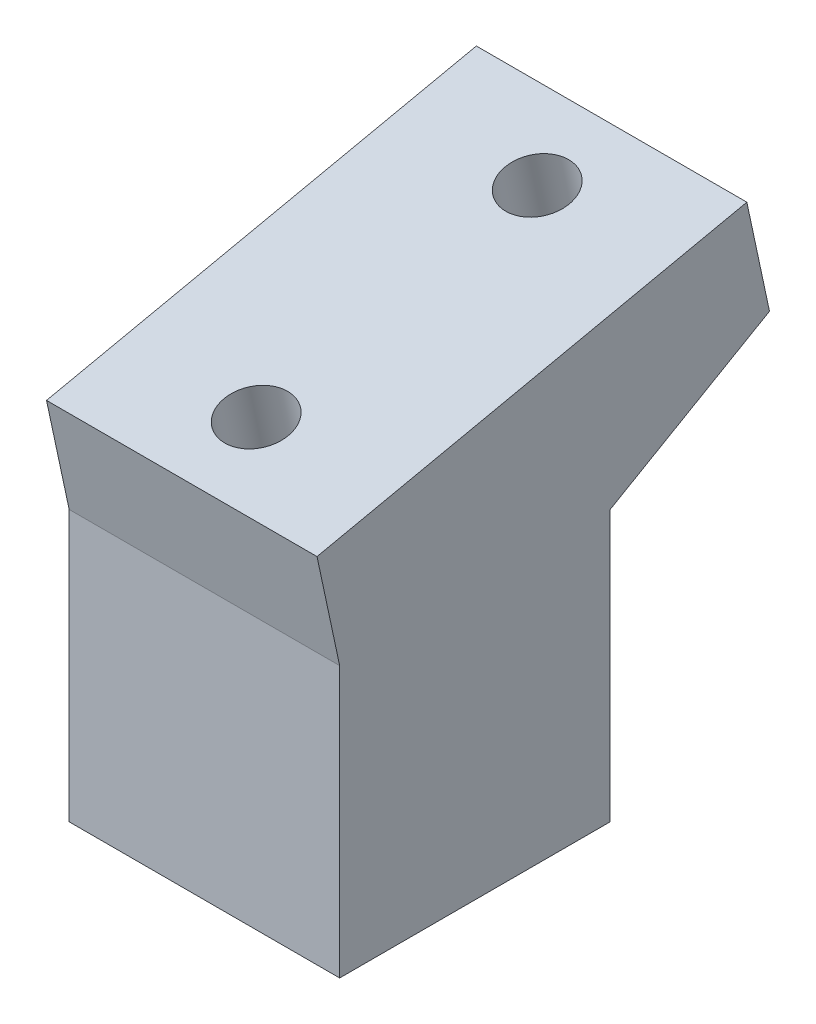
from build123d import *

# Parameters (mm, degrees)
SKETCH_1_W          = 8
SKETCH_1_H          = 8
SKETCH_1_W_2        = 3.05
SKETCH_1_H_2        = 3.05
EXTRUDE_1_DEPTH     = 7.5
SKETCH_2_W          = 8
SKETCH_2_H          = 8
EXTRUDE_2_DEPTH     = 0.5
EXTRUDE_3_DEPTH     = 8
SKETCH_4_R          = 0.95
EXTRUDE_4_DEPTH     = 4
SKETCH_4_2_R        = 0.95
CUT_EXTRUDE_1_DEPTH = 4.2


with BuildPart() as part:
    # 草图1 → 凸台-拉伸1 (new body)
    with BuildSketch(Plane(origin=(0, 0, 0), x_dir=(1, 0, 0), z_dir=(0, 1, 0))):
        with Locations((4, 4)):
            Rectangle(SKETCH_1_W, SKETCH_1_H)
        with Locations((4, 4)):
            Rectangle(SKETCH_1_W_2, SKETCH_1_H_2, mode=Mode.SUBTRACT)
    extrude(amount=EXTRUDE_1_DEPTH)

    # 草图2 → 凸台-拉伸2 (add)
    with BuildSketch(Plane(origin=(0, 7.5, 0), x_dir=(1, 0, 0), z_dir=(0, 1, 0))):
        with Locations((4, 4)):
            Rectangle(SKETCH_2_W, SKETCH_2_H)
    extrude(amount=EXTRUDE_2_DEPTH)

    # 草图3 → 凸台-拉伸3 (add)
    with BuildSketch(Plane(origin=(8, 0, 0), x_dir=(0, 0, -1), z_dir=(1, 0, 0))):
        Polygon((12.042467117, 13.849699628), (12.712142643, 10.720556823), (0, 8), (-0.669675526, 11.129142804), align=None)
        Polygon((8, 8), (12.712142643, 10.720556823), (0, 8), align=None)
    extrude(amount=-EXTRUDE_3_DEPTH)

    # 草图4 → 凸台-拉伸4 (add)
    with BuildSketch(Plane(origin=(0, 10.778779281, 2.306792989), x_dir=(1, 0, 0), z_dir=(0, 0.9778571263703284, 0.2092736017914434))):
        with Locations((4, 3.924188814)):
            Circle(SKETCH_4_R)
        with Locations((4, 12.424188814)):
            Circle(SKETCH_4_R)
    extrude(amount=-EXTRUDE_4_DEPTH)

    # 草图4<2> → 切除-拉伸1 (cut)
    with BuildSketch(Plane(origin=(0, 10.778779281, 2.306792989), x_dir=(1, 0, 0), z_dir=(0, 0.9778571263703284, 0.2092736017914434))):
        with Locations(Location((4, 3.924188814, 0), (0, 0, 270))):
            Circle(SKETCH_4_2_R)
        with Locations(Location((4, 12.424188814, 0), (0, 0, 242.456788252))):
            Circle(SKETCH_4_2_R)
    extrude(amount=-CUT_EXTRUDE_1_DEPTH, mode=Mode.SUBTRACT)


solid = part.part
